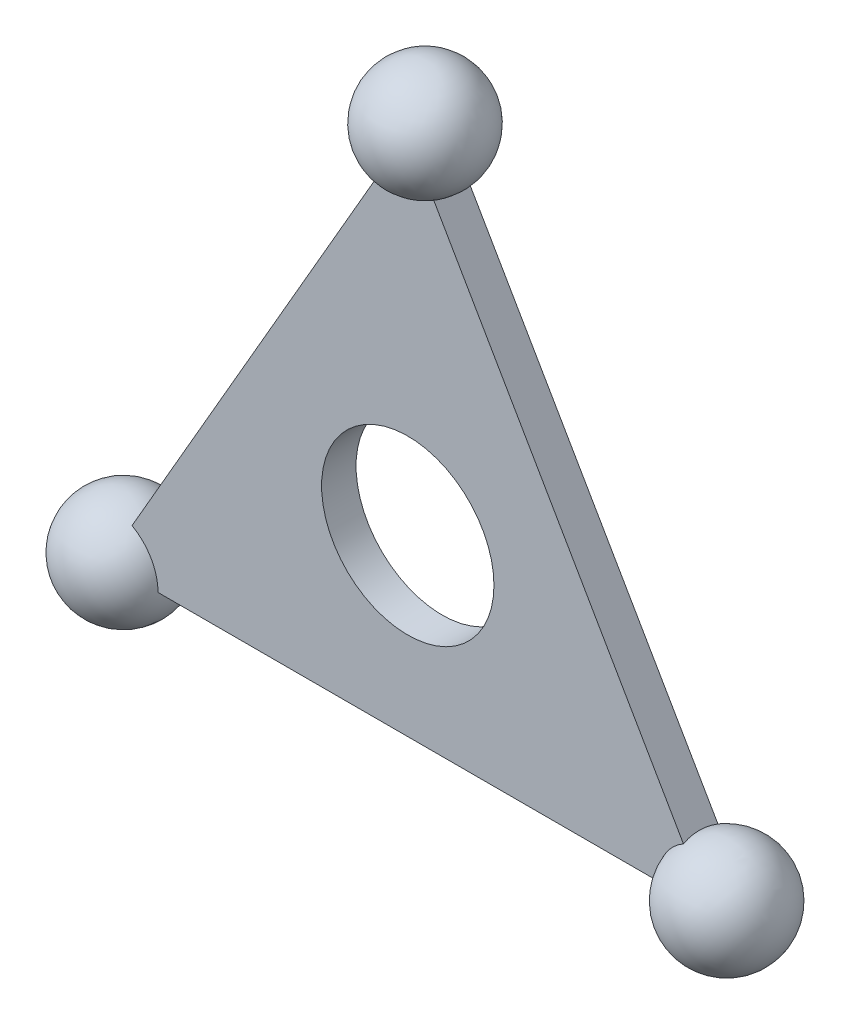
from build123d import *

# Parameters (mm, degrees)
ESQUISSE1_R                  = 10
BOSS_EXTRU_1_DEPTH           = 2
R_P_TITION_CIRCULAIRE1_COUNT = 3


with BuildPart() as part:
    # Esquisse1 → Boss.-Extru.1 (new, symmetric)
    with BuildSketch(Plane.XY):
        Polygon((0, 40.414518843), (-35, -20.207259422), (35, -20.207259422), align=None)
        Circle(ESQUISSE1_R, mode=Mode.SUBTRACT)
    extrude(amount=BOSS_EXTRU_1_DEPTH, both=True)

    # Esquisse3 → Révolution1 (revolve)
    with BuildSketch(Plane.XY):
        with BuildLine():
            Line((0, 46.764518843), (0, 34.064518843))
            ThreePointArc((0, 34.064518843), (-6.35, 40.414518843), (0, 46.764518843))
        make_face()
    r_volution1 = revolve(axis=Axis((0, 46.764518843, 0), (0, -1, 0)))

    # Répétition circulaire1: Révolution1 ×3 about axis
    r_p_tition_circulaire1_axis = Axis((0, 0, 0), (0, 0, 1))
    for i in range(1, R_P_TITION_CIRCULAIRE1_COUNT):
        add(r_volution1.rotate(r_p_tition_circulaire1_axis, i * 360 / R_P_TITION_CIRCULAIRE1_COUNT))


solid = part.part
